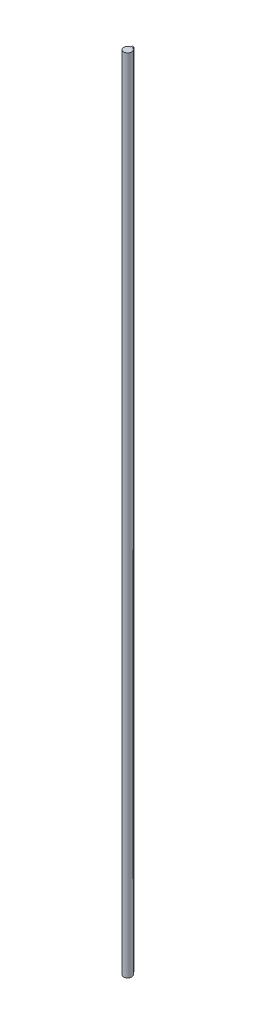
from build123d import *

# Parameters (mm, degrees)
EXTRUDE_1_DEPTH = 2000


with BuildPart() as part:
    # 草图1 → 凸台-拉伸1 (new body)
    with BuildSketch(Plane(origin=(0, 0, 0), x_dir=(1, 0, 0), z_dir=(0, 1, 0))):
        with BuildLine():
            Line((-2, 9.797958971), (-2, 13.797958971))
            Line((-2, 13.797958971), (2, 13.797958971))
            Line((2, 13.797958971), (2, 9.797958971))
            ThreePointArc((2, 9.797958971), (0, -10), (-2, 9.797958971))
        make_face()
    extrude(amount=EXTRUDE_1_DEPTH)


solid = part.part
